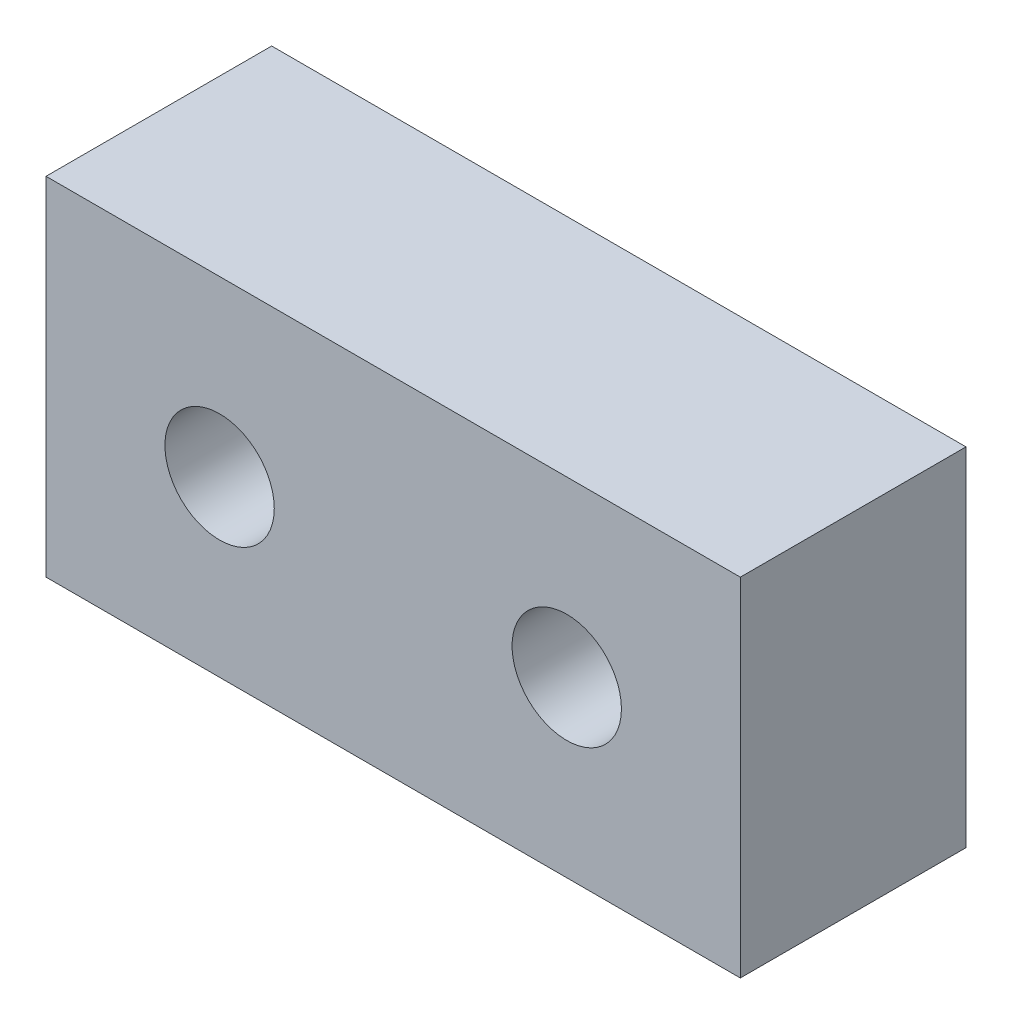
from build123d import *

# Parameters (mm, degrees)
SKETCH_1_W          = 20
SKETCH_1_H          = 10
EXTRUDE_1_DEPTH     = 6.5
SKETCH_2_R          = 1.575
CUT_EXTRUDE_1_DEPTH = 24.286262044


with BuildPart() as part:
    # 草图1 → 凸台-拉伸1 (new body)
    with BuildSketch(Plane.XY):
        with Locations((10, -5)):
            Rectangle(SKETCH_1_W, SKETCH_1_H)
    extrude(amount=EXTRUDE_1_DEPTH)

    # 草图2 → 切除-拉伸1 (cut, through all)
    with BuildSketch(Plane.XY.offset(6.5)):
        with Locations((5, -5)):
            Circle(SKETCH_2_R)
        with Locations((15, -5)):
            Circle(SKETCH_2_R)
    extrude(amount=-CUT_EXTRUDE_1_DEPTH, mode=Mode.SUBTRACT)


solid = part.part
